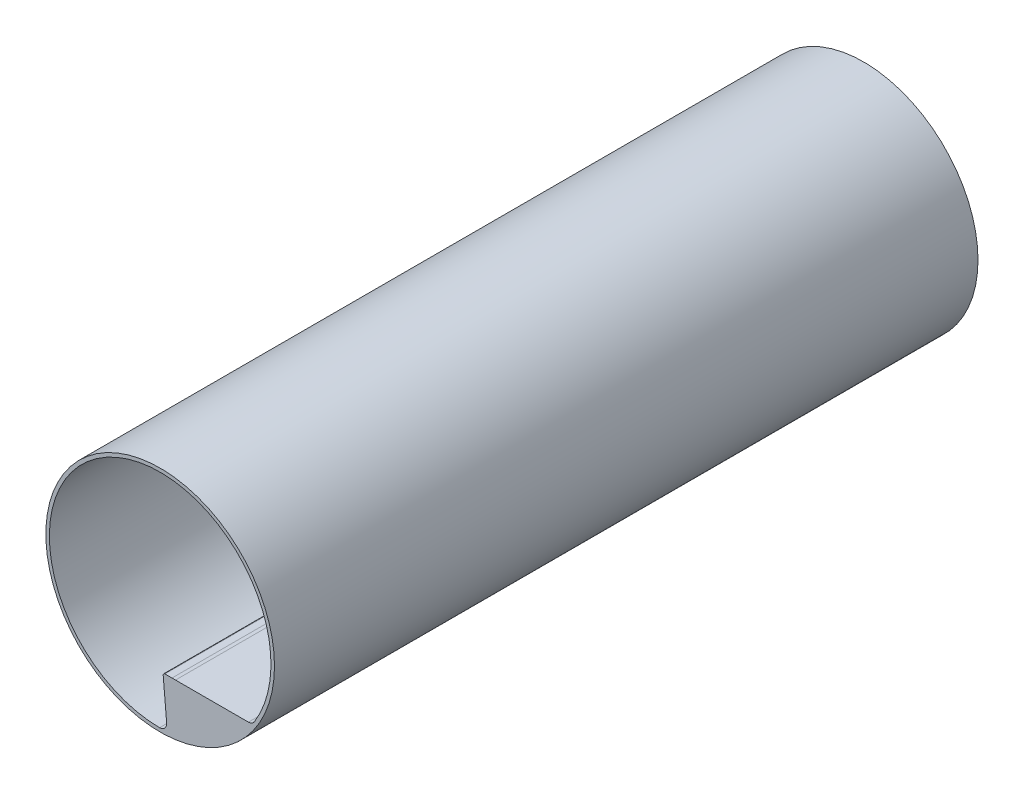
from build123d import *

# Parameters (mm, degrees)
SKETCH2_R           = 3250
BOSS_EXTRUDE1_DEPTH = 20000
FILLET1_R           = 200
FILLET2_R           = 50


with BuildPart() as part:
    # Sketch2 → Boss-Extrude1 (new body)
    with BuildSketch(Plane.XY):
        Circle(SKETCH2_R)
        with BuildLine():
            Line((80.839829258, -1750), (2619.160170742, -1750))
            ThreePointArc((2619.160170742, -1750), (-1573.60607181, 2728.784332036), (202.75248728, -3143.46805756))
            Line((202.75248728, -3143.46805756), (80.839829258, -1750))
        make_face(mode=Mode.SUBTRACT)
    extrude(amount=BOSS_EXTRUDE1_DEPTH)

    # Fillet1
    fillet1_edges = [part.edges().sort_by_distance(p)[0] for p in [
        (2619.160170742, -1750, 10000),
        (202.75248728, -3143.46805756, 10000),
    ]]
    fillet(fillet1_edges, radius=FILLET1_R)

    # Fillet2
    fillet2_edges = [part.edges().sort_by_distance(p)[0] for p in [
        (80.839829258, -1750, 10000),
    ]]
    fillet(fillet2_edges, radius=FILLET2_R)


solid = part.part
